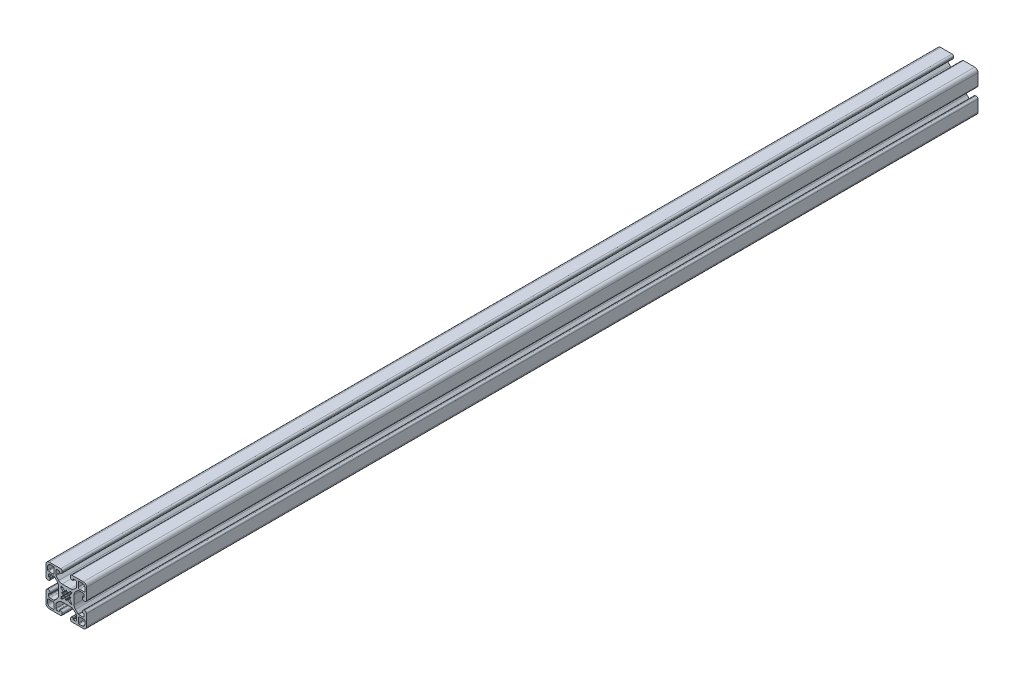
from build123d import *

# Parameters (mm, degrees)
EXTRUDE1_DEPTH = 880


with BuildPart() as part:
    # Sketch1 → Extrude1 (new body)
    with BuildSketch(Plane.XY):
        with BuildLine():
            Line((-5.63, 20), (-16.83, 20))
            ThreePointArc((-16.83, 20), (-19.071528496, 19.071528497), (-20, 16.83))
            Line((-20, 16.83), (-20, 5.63))
            ThreePointArc((-20, 5.63), (-19.540157646, 4.519842354), (-18.43, 4.06))
            Line((-18.43, 4.06), (-17.57, 4.06))
            ThreePointArc((-17.57, 4.06), (-16.459842353, 4.519842354), (-16, 5.63))
            Line((-16, 5.63), (-16, 6.605))
            ThreePointArc((-16, 6.605), (-16.073223305, 6.781776695), (-16.25, 6.855))
            Line((-16.25, 6.855), (-17.25, 6.855))
            ThreePointArc((-17.25, 6.855), (-17.426776695, 6.928223305), (-17.5, 7.105))
            Line((-17.5, 7.105), (-17.5, 9.015))
            ThreePointArc((-17.5, 9.015), (-17.128025612, 9.913025612), (-16.23, 10.285))
            Line((-16.23, 10.285), (-12.216214636, 10.285))
            ThreePointArc((-12.216214636, 10.285), (-11.875626381, 10.217252784), (-11.5868896, 10.024325035))
            Line((-11.5868896, 10.024325035), (-9.076242789, 7.513678224))
            ThreePointArc((-9.076242789, 7.513678224), (-8.046572221, 5.972667318), (-7.685, 4.154921014))
            Line((-7.685, 4.154921014), (-7.685, -4.154921014))
            ThreePointArc((-7.685, -4.154921014), (-8.046572221, -5.972667317), (-9.076242789, -7.513678224))
            Line((-9.076242789, -7.513678224), (-11.5868896, -10.024325035))
            ThreePointArc((-11.5868896, -10.024325035), (-11.875626381, -10.217252784), (-12.216214636, -10.285))
            Line((-12.216214636, -10.285), (-16.23, -10.285))
            ThreePointArc((-16.23, -10.285), (-17.128025612, -9.913025612), (-17.5, -9.015))
            Line((-17.5, -9.015), (-17.5, -7.105))
            ThreePointArc((-17.5, -7.105), (-17.426776695, -6.928223305), (-17.25, -6.855))
            Line((-17.25, -6.855), (-16.25, -6.855))
            ThreePointArc((-16.25, -6.855), (-16.073223305, -6.781776695), (-16, -6.605))
            Line((-16, -6.605), (-16, -5.63))
            ThreePointArc((-16, -5.63), (-16.459842354, -4.519842353), (-17.57, -4.06))
            Line((-17.57, -4.06), (-18.43, -4.06))
            ThreePointArc((-18.43, -4.06), (-19.540157646, -4.519842353), (-20, -5.63))
            Line((-20, -5.63), (-20, -16.83))
            ThreePointArc((-20, -16.83), (-19.071528496, -19.071528496), (-16.83, -20))
            Line((-16.83, -20), (-5.63, -20))
            ThreePointArc((-5.63, -20), (-4.519842354, -19.540157646), (-4.06, -18.43))
            Line((-4.06, -18.43), (-4.06, -17.57))
            ThreePointArc((-4.06, -17.57), (-4.519842354, -16.459842353), (-5.63, -16))
            Line((-5.63, -16), (-6.605, -16))
            ThreePointArc((-6.605, -16), (-6.781776695, -16.073223305), (-6.855, -16.25))
            Line((-6.855, -16.25), (-6.855, -17.25))
            ThreePointArc((-6.855, -17.25), (-6.928223305, -17.426776695), (-7.105, -17.5))
            Line((-7.105, -17.5), (-9.015, -17.5))
            ThreePointArc((-9.015, -17.5), (-9.913025612, -17.128025612), (-10.285, -16.23))
            Line((-10.285, -16.23), (-10.285, -12.216214635))
            ThreePointArc((-10.285, -12.216214635), (-10.217252784, -11.875626381), (-10.024325035, -11.5868896))
            Line((-10.024325035, -11.5868896), (-7.513678224, -9.076242789))
            ThreePointArc((-7.513678224, -9.076242789), (-5.972667317, -8.04657222), (-4.154921014, -7.685))
            Line((-4.154921014, -7.685), (4.154921014, -7.685))
            ThreePointArc((4.154921014, -7.685), (5.972667317, -8.04657222), (7.513678224, -9.076242789))
            Line((7.513678224, -9.076242789), (10.024325035, -11.5868896))
            ThreePointArc((10.024325035, -11.5868896), (10.217252784, -11.875626381), (10.285, -12.216214636))
            Line((10.285, -12.216214636), (10.285, -16.23))
            ThreePointArc((10.285, -16.23), (9.913025612, -17.128025612), (9.015, -17.5))
            Line((9.015, -17.5), (7.105, -17.5))
            ThreePointArc((7.105, -17.5), (6.928223305, -17.426776695), (6.855, -17.25))
            Line((6.855, -17.25), (6.855, -16.25))
            ThreePointArc((6.855, -16.25), (6.781776695, -16.073223305), (6.605, -16))
            Line((6.605, -16), (5.63, -16))
            ThreePointArc((5.63, -16), (4.519842354, -16.459842353), (4.06, -17.57))
            Line((4.06, -17.57), (4.06, -18.43))
            ThreePointArc((4.06, -18.43), (4.519842354, -19.540157646), (5.63, -20))
            Line((5.63, -20), (16.83, -20))
            ThreePointArc((16.83, -20), (19.071528496, -19.071528496), (20, -16.83))
            Line((20, -16.83), (20, -5.63))
            ThreePointArc((20, -5.63), (19.540157646, -4.519842353), (18.43, -4.06))
            Line((18.43, -4.06), (17.57, -4.06))
            ThreePointArc((17.57, -4.06), (16.459842354, -4.519842353), (16, -5.63))
            Line((16, -5.63), (16, -6.605))
            ThreePointArc((16, -6.605), (16.073223305, -6.781776695), (16.25, -6.855))
            Line((16.25, -6.855), (17.25, -6.855))
            ThreePointArc((17.25, -6.855), (17.426776695, -6.928223305), (17.5, -7.105))
            Line((17.5, -7.105), (17.5, -9.015))
            ThreePointArc((17.5, -9.015), (17.128025612, -9.913025612), (16.23, -10.285))
            Line((16.23, -10.285), (12.216214636, -10.285))
            ThreePointArc((12.216214636, -10.285), (11.875626381, -10.217252784), (11.5868896, -10.024325035))
            Line((11.5868896, -10.024325035), (9.076242789, -7.513678224))
            ThreePointArc((9.076242789, -7.513678224), (8.046572221, -5.972667317), (7.685, -4.154921014))
            Line((7.685, -4.154921014), (7.685, 4.154921014))
            ThreePointArc((7.685, 4.154921014), (8.046572221, 5.972667318), (9.076242789, 7.513678224))
            Line((9.076242789, 7.513678224), (11.5868896, 10.024325035))
            ThreePointArc((11.5868896, 10.024325035), (11.875626381, 10.217252784), (12.216214636, 10.285))
            Line((12.216214636, 10.285), (16.23, 10.285))
            ThreePointArc((16.23, 10.285), (17.128025612, 9.913025612), (17.5, 9.015))
            Line((17.5, 9.015), (17.5, 7.105))
            ThreePointArc((17.5, 7.105), (17.426776695, 6.928223305), (17.25, 6.855))
            Line((17.25, 6.855), (16.25, 6.855))
            ThreePointArc((16.25, 6.855), (16.073223305, 6.781776695), (16, 6.605))
            Line((16, 6.605), (16, 5.63))
            ThreePointArc((16, 5.63), (16.459842354, 4.519842354), (17.57, 4.06))
            Line((17.57, 4.06), (18.43, 4.06))
            ThreePointArc((18.43, 4.06), (19.540157646, 4.519842354), (20, 5.63))
            Line((20, 5.63), (20, 16.83))
            ThreePointArc((20, 16.83), (19.071528496, 19.071528496), (16.83, 20))
            Line((16.83, 20), (5.63, 20))
            ThreePointArc((5.63, 20), (4.519842354, 19.540157647), (4.06, 18.43))
            Line((4.06, 18.43), (4.06, 17.57))
            ThreePointArc((4.06, 17.57), (4.519842354, 16.459842354), (5.63, 16))
            Line((5.63, 16), (6.605, 16))
            ThreePointArc((6.605, 16), (6.781776695, 16.073223305), (6.855, 16.25))
            Line((6.855, 16.25), (6.855, 17.25))
            ThreePointArc((6.855, 17.25), (6.928223305, 17.426776695), (7.105, 17.5))
            Line((7.105, 17.5), (9.015, 17.5))
            ThreePointArc((9.015, 17.5), (9.913025612, 17.128025612), (10.285, 16.23))
            Line((10.285, 16.23), (10.285, 12.216214636))
            ThreePointArc((10.285, 12.216214636), (10.217252784, 11.875626381), (10.024325035, 11.5868896))
            Line((10.024325035, 11.5868896), (7.513678224, 9.07624279))
            ThreePointArc((7.513678224, 9.07624279), (5.972667317, 8.046572221), (4.154921014, 7.685))
            Line((4.154921014, 7.685), (-4.154921014, 7.685))
            ThreePointArc((-4.154921014, 7.685), (-5.972667317, 8.046572221), (-7.513678224, 9.07624279))
            Line((-7.513678224, 9.07624279), (-10.024325035, 11.5868896))
            ThreePointArc((-10.024325035, 11.5868896), (-10.217252784, 11.875626381), (-10.285, 12.216214636))
            Line((-10.285, 12.216214636), (-10.285, 16.23))
            ThreePointArc((-10.285, 16.23), (-9.913025612, 17.128025612), (-9.015, 17.5))
            Line((-9.015, 17.5), (-7.105, 17.5))
            ThreePointArc((-7.105, 17.5), (-6.928223305, 17.426776695), (-6.855, 17.25))
            Line((-6.855, 17.25), (-6.855, 16.25))
            ThreePointArc((-6.855, 16.25), (-6.781776695, 16.073223305), (-6.605, 16))
            Line((-6.605, 16), (-5.63, 16))
            ThreePointArc((-5.63, 16), (-4.519842354, 16.459842354), (-4.06, 17.57))
            Line((-4.06, 17.57), (-4.06, 18.43))
            ThreePointArc((-4.06, 18.43), (-4.519842354, 19.540157647), (-5.63, 20))
        make_face()
        with BuildLine():
            Line((12.4898, -18.345), (15.545, -18.345))
            ThreePointArc((15.545, -18.345), (17.524898987, -17.524898987), (18.345, -15.545))
            Line((18.345, -15.545), (18.345, -12.4898))
            ThreePointArc((18.345, -12.4898), (18.160477272, -12.044322728), (17.715, -11.8598))
            Line((17.715, -11.8598), (13.1298, -11.8598))
            ThreePointArc((13.1298, -11.8598), (12.231774388, -12.231774388), (11.8598, -13.1298))
            Line((11.8598, -13.1298), (11.8598, -17.715))
            ThreePointArc((11.8598, -17.715), (12.044322728, -18.160477272), (12.4898, -18.345))
        make_face(mode=Mode.SUBTRACT)
        with BuildLine():
            Line((-18.345, -12.4898), (-18.345, -15.545))
            ThreePointArc((-18.345, -15.545), (-17.524898987, -17.524898987), (-15.545, -18.345))
            Line((-15.545, -18.345), (-12.4898, -18.345))
            ThreePointArc((-12.4898, -18.345), (-12.044322728, -18.160477272), (-11.8598, -17.715))
            Line((-11.8598, -17.715), (-11.8598, -13.1298))
            ThreePointArc((-11.8598, -13.1298), (-12.231774388, -12.231774388), (-13.1298, -11.8598))
            Line((-13.1298, -11.8598), (-17.715, -11.8598))
            ThreePointArc((-17.715, -11.8598), (-18.160477272, -12.044322728), (-18.345, -12.4898))
        make_face(mode=Mode.SUBTRACT)
        with BuildLine():
            Line((18.345, 12.4898), (18.345, 15.545))
            ThreePointArc((18.345, 15.545), (17.524898987, 17.524898987), (15.545, 18.345))
            Line((15.545, 18.345), (12.4898, 18.345))
            ThreePointArc((12.4898, 18.345), (12.044322728, 18.160477272), (11.8598, 17.715))
            Line((11.8598, 17.715), (11.8598, 13.1298))
            ThreePointArc((11.8598, 13.1298), (12.231774388, 12.231774388), (13.1298, 11.8598))
            Line((13.1298, 11.8598), (17.715, 11.8598))
            ThreePointArc((17.715, 11.8598), (18.160477272, 12.044322728), (18.345, 12.4898))
        make_face(mode=Mode.SUBTRACT)
        with BuildLine():
            Line((-12.4898, 18.345), (-15.545, 18.345))
            ThreePointArc((-15.545, 18.345), (-17.524898987, 17.524898987), (-18.345, 15.545))
            Line((-18.345, 15.545), (-18.345, 12.4898))
            ThreePointArc((-18.345, 12.4898), (-18.160477272, 12.044322728), (-17.715, 11.8598))
            Line((-17.715, 11.8598), (-13.1298, 11.8598))
            ThreePointArc((-13.1298, 11.8598), (-12.231774388, 12.231774388), (-11.8598, 13.1298))
            Line((-11.8598, 13.1298), (-11.8598, 17.715))
            ThreePointArc((-11.8598, 17.715), (-12.044322728, 18.160477272), (-12.4898, 18.345))
        make_face(mode=Mode.SUBTRACT)
        with BuildLine():
            Line((-4.84811685, -5.43930974), (-3.712038621, -5.126252183))
            Line((-3.712038621, -5.126252183), (-1.590718277, -3.00493184))
            ThreePointArc((-1.590718277, -3.00493184), (-1.120609643, -3.210020877), (-0.625, -3.342061489))
            Line((-0.625, -3.342061489), (-0.492259234, -4.087640441))
            ThreePointArc((-0.492259234, -4.087640441), (0, -4.5), (0.492259234, -4.087640441))
            Line((0.492259234, -4.087640441), (0.625, -3.342061489))
            ThreePointArc((0.625, -3.342061489), (1.120609643, -3.210020877), (1.590718277, -3.00493184))
            Line((1.590718277, -3.00493184), (3.712038621, -5.126252183))
            Line((3.712038621, -5.126252183), (4.84811685, -5.43930974))
            ThreePointArc((4.84811685, -5.43930974), (5.303300859, -5.303300859), (5.43930974, -4.84811685))
            Line((5.43930974, -4.84811685), (5.126252183, -3.712038621))
            Line((5.126252183, -3.712038621), (3.00493184, -1.590718277))
            ThreePointArc((3.00493184, -1.590718277), (3.210020877, -1.120609643), (3.342061489, -0.625))
            Line((3.342061489, -0.625), (4.087640441, -0.492259234))
            ThreePointArc((4.087640441, -0.492259234), (4.5, 0), (4.087640441, 0.492259234))
            Line((4.087640441, 0.492259234), (3.342061489, 0.625))
            ThreePointArc((3.342061489, 0.625), (3.210020877, 1.120609643), (3.00493184, 1.590718277))
            Line((3.00493184, 1.590718277), (5.126252183, 3.712038621))
            Line((5.126252183, 3.712038621), (5.43930974, 4.84811685))
            ThreePointArc((5.43930974, 4.84811685), (5.303300859, 5.303300859), (4.84811685, 5.43930974))
            Line((4.84811685, 5.43930974), (3.712038621, 5.126252183))
            Line((3.712038621, 5.126252183), (1.590718277, 3.00493184))
            ThreePointArc((1.590718277, 3.00493184), (1.120609643, 3.210020877), (0.625, 3.342061489))
            Line((0.625, 3.342061489), (0.492259234, 4.087640441))
            ThreePointArc((0.492259234, 4.087640441), (0, 4.5), (-0.492259234, 4.087640441))
            Line((-0.492259234, 4.087640441), (-0.625, 3.342061489))
            ThreePointArc((-0.625, 3.342061489), (-1.120609643, 3.210020877), (-1.590718277, 3.00493184))
            Line((-1.590718277, 3.00493184), (-3.712038621, 5.126252183))
            Line((-3.712038621, 5.126252183), (-4.84811685, 5.43930974))
            ThreePointArc((-4.84811685, 5.43930974), (-5.303300859, 5.303300859), (-5.43930974, 4.84811685))
            Line((-5.43930974, 4.84811685), (-5.126252183, 3.712038621))
            Line((-5.126252183, 3.712038621), (-3.00493184, 1.590718277))
            ThreePointArc((-3.00493184, 1.590718277), (-3.210020877, 1.120609643), (-3.342061489, 0.625))
            Line((-3.342061489, 0.625), (-4.087640441, 0.492259234))
            ThreePointArc((-4.087640441, 0.492259234), (-4.5, 0), (-4.087640441, -0.492259234))
            Line((-4.087640441, -0.492259234), (-3.342061489, -0.625))
            ThreePointArc((-3.342061489, -0.625), (-3.210020877, -1.120609643), (-3.00493184, -1.590718277))
            Line((-3.00493184, -1.590718277), (-5.126252183, -3.712038621))
            Line((-5.126252183, -3.712038621), (-5.43930974, -4.84811685))
            ThreePointArc((-5.43930974, -4.84811685), (-5.303300859, -5.303300859), (-4.84811685, -5.43930974))
        make_face(mode=Mode.SUBTRACT)
    extrude(amount=-EXTRUDE1_DEPTH)


solid = part.part
